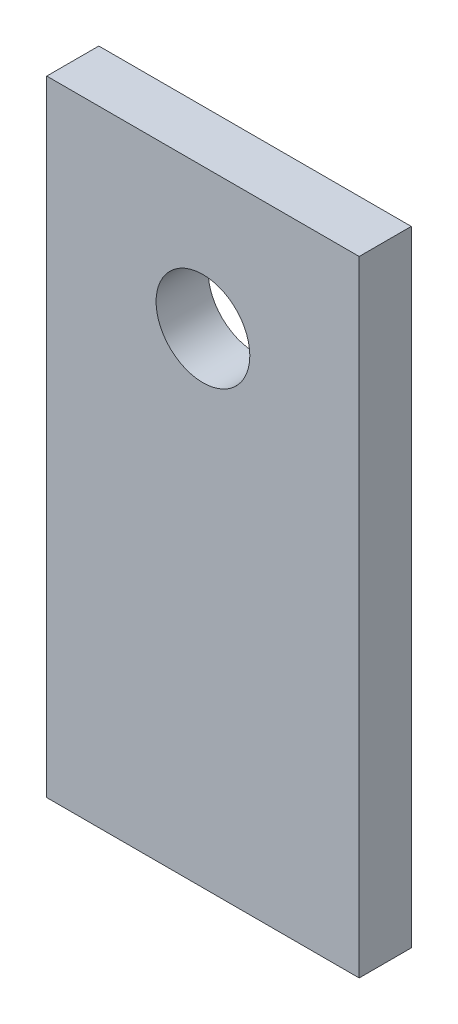
from build123d import *

# Parameters (mm, degrees)
SZKIC2_W                    = 30
SZKIC2_H                    = 60
SZKIC2_R                    = 4.5
DODANIE_WYCI_GNI_CIE1_DEPTH = 5


with BuildPart() as part:
    # Szkic2 → Dodanie-wyciągnięcie1 (new body)
    with BuildSketch(Plane.XY):
        with Locations((15, 30)):
            Rectangle(SZKIC2_W, SZKIC2_H)
        with Locations((15, 46.5)):
            Circle(SZKIC2_R, mode=Mode.SUBTRACT)
    extrude(amount=DODANIE_WYCI_GNI_CIE1_DEPTH)


solid = part.part
